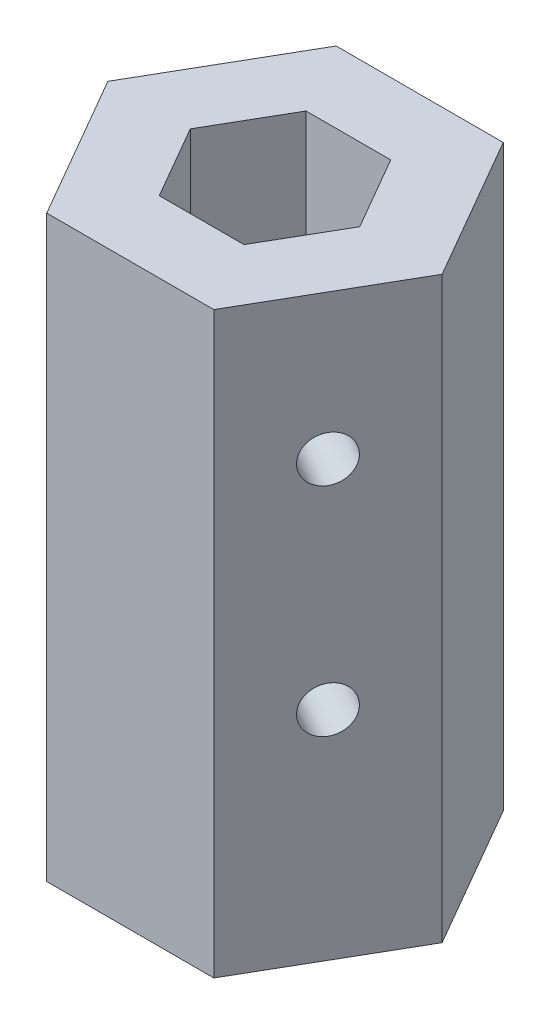
from build123d import *

# Parameters (mm, degrees)
BOSS_EXTRUDE1_DEPTH = 50.8
BOSS_EXTRUDE2_DEPTH = 6.35
SKETCH3_R           = 2.0193
CUT_EXTRUDE1_DEPTH  = 61.017858453
SKETCH4_R           = 2.6289
CUT_EXTRUDE2_DEPTH  = 57.954059175


with BuildPart() as part:
    # Sketch1 → Boss-Extrude1 (new body)
    with BuildSketch(Plane(origin=(0, 0, 0), x_dir=(1, 0, 0), z_dir=(0, 1, 0))):
        Polygon((7.332348419, 12.7), (-7.332348419, 12.7), (-14.664696837, 0), (-7.332348419, -12.7), (7.332348419, -12.7), (14.664696837, 0), align=None)
        Polygon((3.717500648, 6.4389), (-3.717500648, 6.4389), (-7.435001297, 0), (-3.717500648, -6.4389), (3.717500648, -6.4389), (7.435001297, 0), align=None, mode=Mode.SUBTRACT)
    extrude(amount=BOSS_EXTRUDE1_DEPTH)

    # Sketch2 → Boss-Extrude2 (add)
    with BuildSketch(Plane.XZ):
        Polygon((3.717500648, -6.4389), (-3.717500648, -6.4389), (-7.435001297, 0), (-3.717500648, 6.4389), (3.717500648, 6.4389), (7.435001297, 0), align=None)
    extrude(amount=-BOSS_EXTRUDE2_DEPTH)

    # Sketch3 → Cut-Extrude1 (cut, through all)
    with BuildSketch(Plane(origin=(10.998522628, 0, 6.35), x_dir=(0.5000000000000001, 0, -0.8660254037844386), z_dir=(0.8660254037844386, 0, 0.5000000000000001))):
        with Locations((0, 19.05)):
            Circle(SKETCH3_R)
        with Locations((0, 38.1)):
            Circle(SKETCH3_R)
    extrude(amount=-CUT_EXTRUDE1_DEPTH, mode=Mode.SUBTRACT)

    # Sketch4 → Cut-Extrude2 (cut, through all)
    with BuildSketch(Plane(origin=(-5.576250972, 0, -3.21945), x_dir=(0.49999999999999967, 0, -0.8660254037844388), z_dir=(0.8660254037844388, 0, 0.49999999999999967))):
        with Locations((0, 38.1)):
            Circle(SKETCH4_R)
        with Locations((0, 19.05)):
            Circle(SKETCH4_R)
    extrude(amount=-CUT_EXTRUDE2_DEPTH, mode=Mode.SUBTRACT)


solid = part.part
